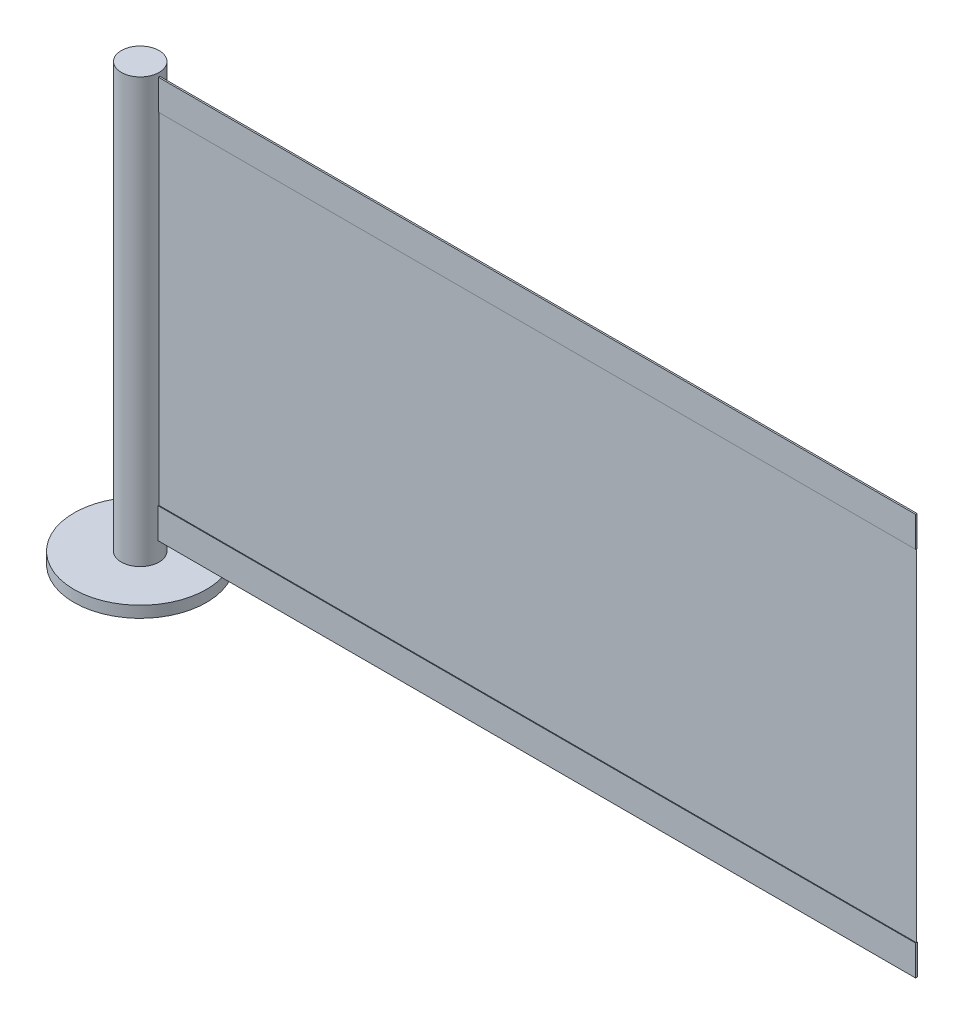
from build123d import *

# Parameters (mm, degrees)
SKETCH2_R           = 175
BOSS_EXTRUDE1_DEPTH = 30
SKETCH3_R           = 50
BOSS_EXTRUDE2_DEPTH = 1110
SKETCH7_W           = 2050
SKETCH7_H           = 1
BOSS_EXTRUDE3_DEPTH = 1060
SKETCH8_W           = 2050
SKETCH8_H           = 4
BOSS_EXTRUDE4_DEPTH = 80
SKETCH11_W          = 2050
SKETCH11_H          = 4.938385514
BOSS_EXTRUDE5_DEPTH = 80
SKETCH12_R          = 50
BOSS_EXTRUDE6_DEPTH = 10


with BuildPart() as part:
    # Sketch2 → Boss-Extrude1 (new body)
    with BuildSketch(Plane(origin=(0, 0, 0), x_dir=(1, 0, 0), z_dir=(0, 1, 0))):
        with Locations(Location((0, 0, 0), (0, 0, 270))):
            Circle(SKETCH2_R)
    extrude(amount=BOSS_EXTRUDE1_DEPTH)

    # Sketch3 → Boss-Extrude2 (add)
    with BuildSketch(Plane(origin=(0, 30, 0), x_dir=(1, 0, 0), z_dir=(0, 1, 0))):
        with Locations(Location((0, 0, 0), (0, 0, 270))):
            Circle(SKETCH3_R)
    extrude(amount=BOSS_EXTRUDE2_DEPTH)

    # Sketch7 → Boss-Extrude3 (add)
    with BuildSketch(Plane(origin=(0, 1140, 0), x_dir=(1, 0, 0), z_dir=(0, 1, 0))):
        with Locations((1025, 0)):
            Rectangle(SKETCH7_W, SKETCH7_H)
    extrude(amount=-BOSS_EXTRUDE3_DEPTH)

    # Sketch8 → Boss-Extrude4 (add)
    with BuildSketch(Plane(origin=(0, 1140, 0), x_dir=(1, 0, 0), z_dir=(0, 1, 0))):
        with Locations((1025, 0)):
            Rectangle(SKETCH8_W, SKETCH8_H)
    extrude(amount=-BOSS_EXTRUDE4_DEPTH)

    # Sketch11 → Boss-Extrude5 (add)
    with BuildSketch(Plane(origin=(0, 80, 0), x_dir=(-1, 0, 0), z_dir=(0, -1, 0))):
        with Locations((-1025, 0)):
            Rectangle(SKETCH11_W, SKETCH11_H)
    extrude(amount=-BOSS_EXTRUDE5_DEPTH)

    # Sketch12 → Boss-Extrude6 (add)
    with BuildSketch(Plane(origin=(0, 1140, 0), x_dir=(1, 0, 0), z_dir=(0, 1, 0))):
        with Locations(Location((0, 0, 0), (0, 0, 270))):
            Circle(SKETCH12_R)
    extrude(amount=BOSS_EXTRUDE6_DEPTH)


solid = part.part
